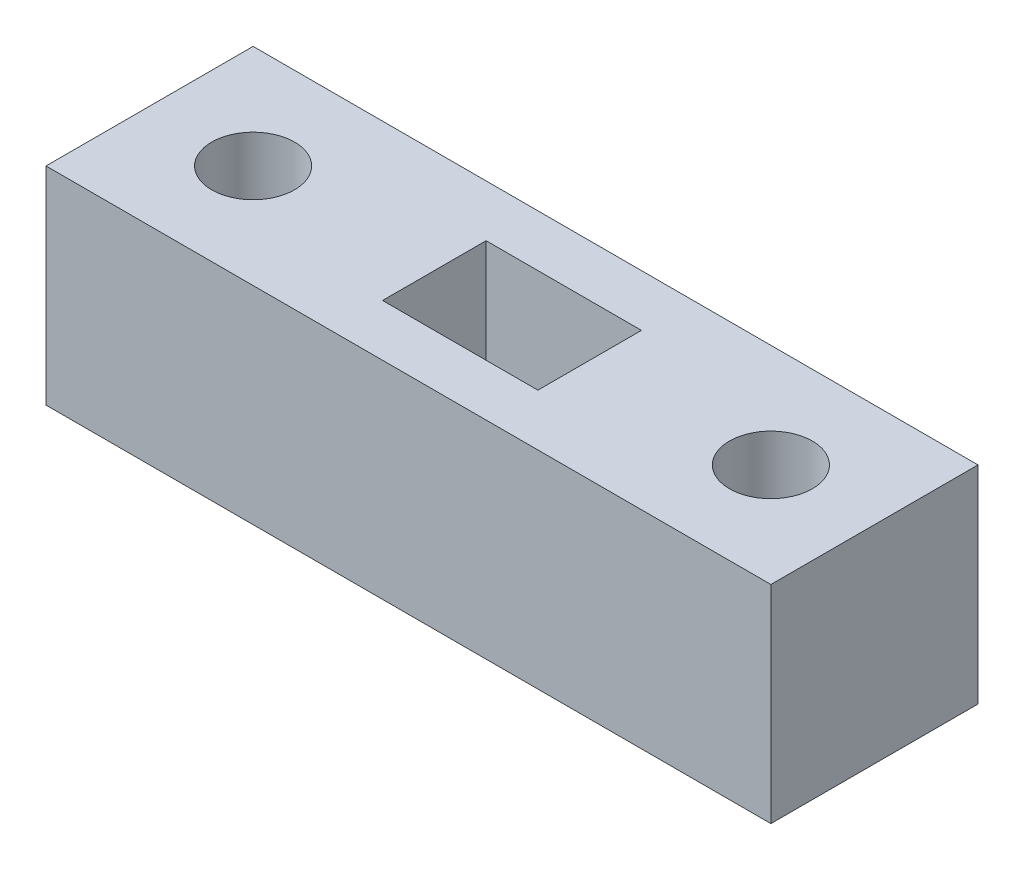
from build123d import *

# Parameters (mm, degrees)
SKETCH1_W           = 70
SKETCH1_H           = 20
SKETCH1_R           = 4
SKETCH1_W_2         = 15
SKETCH1_H_2         = 10
BOSS_EXTRUDE1_DEPTH = 20


with BuildPart() as part:
    # Sketch1 → Boss-Extrude1 (new body)
    with BuildSketch(Plane(origin=(0, 0, 0), x_dir=(1, 0, 0), z_dir=(0, 1, 0))):
        Rectangle(SKETCH1_W, SKETCH1_H)
        with Locations(Location((-25, 0, 0), (0, 0, 270))):
            Circle(SKETCH1_R, mode=Mode.SUBTRACT)
        with Locations(Location((25, 0, 0), (0, 0, 90))):
            Circle(SKETCH1_R, mode=Mode.SUBTRACT)
        Rectangle(SKETCH1_W_2, SKETCH1_H_2, mode=Mode.SUBTRACT)
    extrude(amount=BOSS_EXTRUDE1_DEPTH)


solid = part.part
